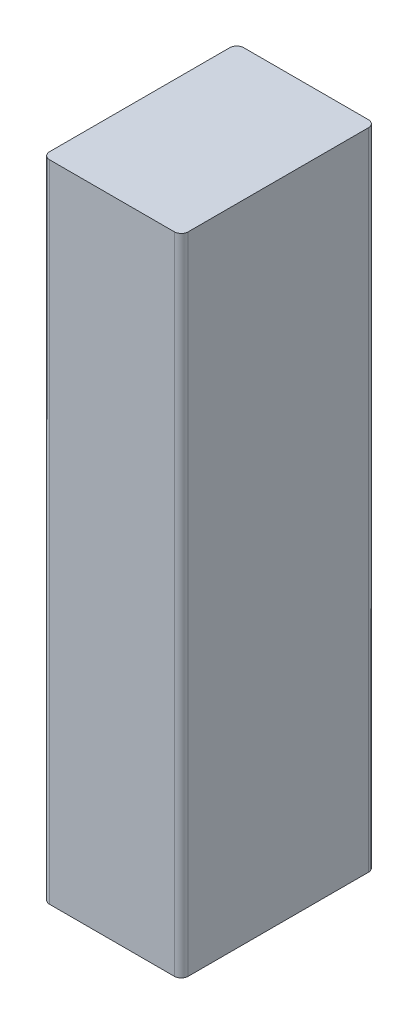
from build123d import *

# Parameters (mm, degrees)
EXTRUDE_2_DEPTH = 93


with BuildPart() as part:
    # 草图1 → 凸台-拉伸2 (new body)
    with BuildSketch(Plane(origin=(0, 0, 0), x_dir=(1, 0, 0), z_dir=(0, 1, 0))):
        with BuildLine():
            Line((32.105018557, 18.104863022), (50.105018557, 18.104863022))
            ThreePointArc((50.105018557, 18.104863022), (50.812125339, 17.811969803), (51.105018557, 17.104863022))
            Line((51.105018557, 17.104863022), (51.105018557, -8.895136978))
            ThreePointArc((51.105018557, -8.895136978), (50.812125339, -9.602243759), (50.105018557, -9.895136978))
            Line((50.105018557, -9.895136978), (32.105018557, -9.895136978))
            ThreePointArc((32.105018557, -9.895136978), (31.397911776, -9.602243759), (31.105018557, -8.895136978))
            Line((31.105018557, -8.895136978), (31.105018557, 17.104863022))
            ThreePointArc((31.105018557, 17.104863022), (31.397911776, 17.811969803), (32.105018557, 18.104863022))
        make_face()
    extrude(amount=EXTRUDE_2_DEPTH)


solid = part.part
